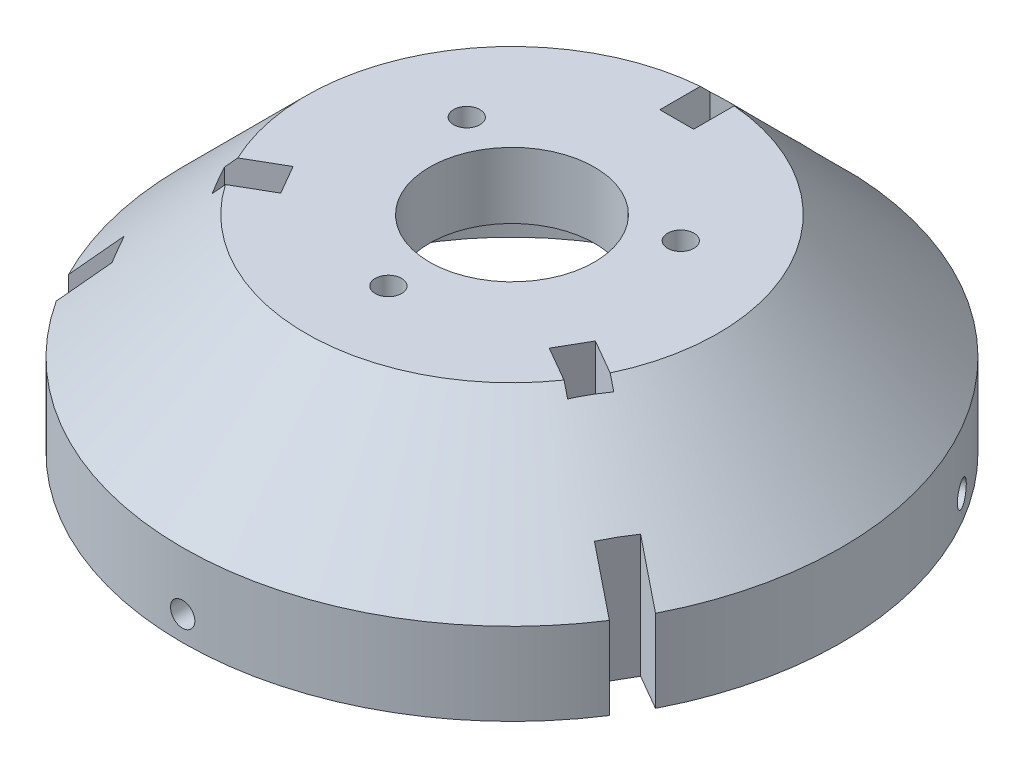
from build123d import *

# Parameters (mm, degrees)
SKETCH_2_R               = 10
SKETCH_2_R_2             = 1.6
SKETCH_2_W               = 4.1
SKETCH_2_H               = 6.1
CUT_EXTRUDE_1_DEPTH      = 42
SKETCH_3_R               = 1.475
CUT_EXTRUDE_2_DEPTH      = 15
PATTERN_CIRCULAR_1_COUNT = 3


with BuildPart() as part:
    # 草图1 → 旋转1 (revolve)
    with BuildSketch(Plane(origin=(0, 0, 0), x_dir=(0, 0, -1), z_dir=(1, 0, 0)), mode=Mode.PRIVATE) as revolve_1_sk:
        Polygon((0, 25), (-25, 25), (-40, 10), (-40, 0), (-32, 0), (-32, 6.686291501), (-21.686291501, 17), (0, 17), align=None)
    revolve(revolve_1_sk.sketch.rotate(Axis((0, 0, 0), (0, 1, 0)), 180), axis=Axis((0, 0, 0), (0, 1, 0)))

    # 草图2 → 切除-拉伸1 (cut)
    with BuildSketch(Plane(origin=(0, 25, 0), x_dir=(1, 0, 0), z_dir=(0, 1, 0))):
        with Locations(Location((0, 0, 0), (0, 0, 270))):
            Circle(SKETCH_2_R)
        with Locations(Location((12.990381057, 7.5, 0), (0, 0, 270))):
            Circle(SKETCH_2_R_2)
        with Locations(Location((0, -15, 0), (0, 0, 270))):
            Circle(SKETCH_2_R_2)
        with Locations(Location((-12.990381057, 7.5, 0), (0, 0, 270))):
            Circle(SKETCH_2_R_2)
        Polygon((36.618644096, -18.774647922), (31.335889132, -15.724647922), (29.285889132, -19.275352078), (34.568644096, -22.325352078), align=None)
        with Locations((0, 23.05)):
            Rectangle(SKETCH_2_W, SKETCH_2_H)
        with Locations((0, 38.05)):
            Rectangle(SKETCH_2_W, SKETCH_2_H)
        Polygon((18.345508076, -8.224647922), (23.628263039, -11.274647922), (21.578263039, -14.825352078), (16.295508076, -11.775352078), align=None)
        Polygon((-34.568644096, -22.325352078), (-29.285889132, -19.275352078), (-31.335889132, -15.724647922), (-36.618644096, -18.774647922), align=None)
        Polygon((-16.295508076, -11.775352078), (-21.578263039, -14.825352078), (-23.628263039, -11.274647922), (-18.345508076, -8.224647922), align=None)
    extrude(amount=-CUT_EXTRUDE_1_DEPTH, mode=Mode.SUBTRACT)

    # 草图3 → 切除-拉伸2 (cut)
    with BuildSketch(Plane.XY.offset(40)):
        with Locations((0, 3)):
            Circle(SKETCH_3_R)
    cut_extrude_2 = extrude(amount=-CUT_EXTRUDE_2_DEPTH, mode=Mode.SUBTRACT)

    # 阵列(圆周)1: 切除-拉伸2 ×3 about axis
    pattern_circular_1_axis = Axis((0, 10, 0), (0, -1, 0))
    for i in range(1, PATTERN_CIRCULAR_1_COUNT):
        add(cut_extrude_2.rotate(pattern_circular_1_axis, i * 360 / PATTERN_CIRCULAR_1_COUNT), mode=Mode.SUBTRACT)


solid = part.part
